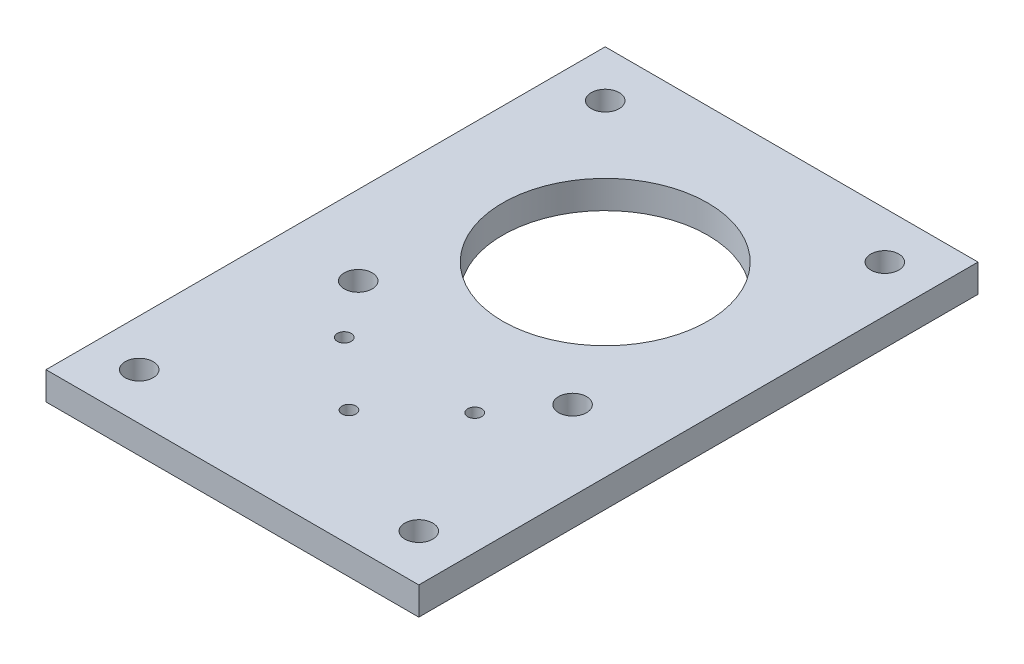
from build123d import *

# Parameters (mm, degrees)
SKETCH_1_W      = 40
SKETCH_1_H      = 60
SKETCH_1_R      = 11
SKETCH_1_R_2    = 1.5
SKETCH_1_R_3    = 0.75
EXTRUDE_1_DEPTH = 3


with BuildPart() as part:
    # 草图1 → 凸台-拉伸1 (new body)
    with BuildSketch(Plane(origin=(0, 0, 0), x_dir=(1, 0, 0), z_dir=(0, 1, 0))):
        with Locations((0, -10)):
            Rectangle(SKETCH_1_W, SKETCH_1_H)
        with Locations(Location((0, 0, 0), (0, 0, 270))):
            Circle(SKETCH_1_R, mode=Mode.SUBTRACT)
        with Locations(Location((-15, 15, 0), (0, 0, 270))):
            Circle(SKETCH_1_R_2, mode=Mode.SUBTRACT)
        with Locations(Location((15, 15, 0), (0, 0, 270))):
            Circle(SKETCH_1_R_2, mode=Mode.SUBTRACT)
        with Locations(Location((15, -35, 0), (0, 0, 270))):
            Circle(SKETCH_1_R_2, mode=Mode.SUBTRACT)
        with Locations(Location((-15, -35, 0), (0, 0, 270))):
            Circle(SKETCH_1_R_2, mode=Mode.SUBTRACT)
        with Locations(Location((0, -27.5, 0), (0, 0, 270))):
            Circle(SKETCH_1_R_3, mode=Mode.SUBTRACT)
        with Locations(Location((-7, -21, 0), (0, 0, 270))):
            Circle(SKETCH_1_R_3, mode=Mode.SUBTRACT)
        with Locations(Location((7, -21, 0), (0, 0, 270))):
            Circle(SKETCH_1_R_3, mode=Mode.SUBTRACT)
        with Locations(Location((-11.5, -15, 0), (0, 0, 270))):
            Circle(SKETCH_1_R_2, mode=Mode.SUBTRACT)
        with Locations(Location((11.5, -15, 0), (0, 0, 270))):
            Circle(SKETCH_1_R_2, mode=Mode.SUBTRACT)
    extrude(amount=EXTRUDE_1_DEPTH)


solid = part.part
